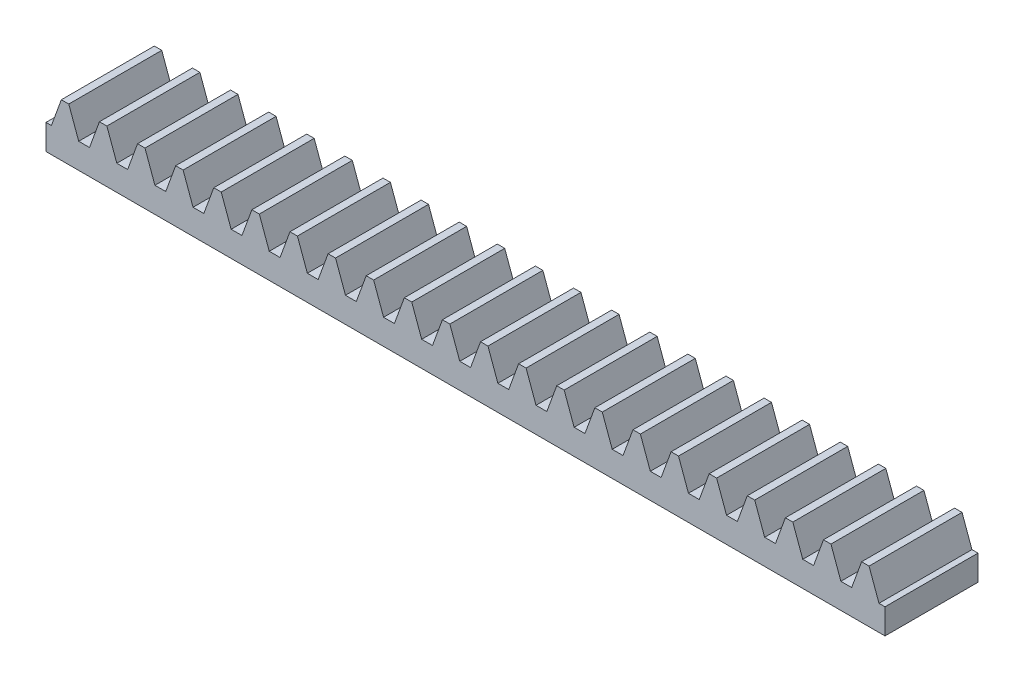
from build123d import *

# Parameters (mm, degrees)
BLANKSKE_W         = 41.5
BLANKSKE_H         = 2.6
BLANK_DEPTH        = 5
TOOTHCUTSIM_DEPTH  = 42.880902569
TEETHCUTS_COUNT    = 23
TEETHCUTS_PITCH    = 1.88495559
CUT_EXTRUDE1_DEPTH = 0.2
CUT_EXTRUDE2_DEPTH = 0.2


with BuildPart() as part:
    # BlankSke → Blank (new body)
    with BuildSketch(Plane.XY):
        with Locations((20.75, 1.3)):
            Rectangle(BLANKSKE_W, BLANKSKE_H)
    extrude(amount=-BLANK_DEPTH)

    # TooCutSkeSim → ToothCutSim (cut, through all)
    with BuildSketch(Plane.XY):
        Polygon((0.267261222, 1.25), (-0.267261222, 1.25), (-0.767865882, 2.6254), (0.767865882, 2.6254), align=None)
    toothcutsim = extrude(amount=-TOOTHCUTSIM_DEPTH, mode=Mode.SUBTRACT)

    # TeethCuts: ToothCutSim ×23
    with Locations(*[(i * TEETHCUTS_PITCH, 0, 0) for i in range(1, TEETHCUTS_COUNT)]):
        add(toothcutsim, mode=Mode.SUBTRACT)

    # Sketch1 → Cut-Extrude1 (cut)
    with BuildSketch(Plane.XY):
        Polygon((41.5, 1.25), (41.201761758, 1.25), (40.710401942, 2.6), (40.342688428, 2.6), (39.851328612, 1.25), (39.316806168, 1.25), (38.825446352, 2.6), (38.457732838, 2.6), (37.966373022, 1.25), (37.431850578, 1.25), (36.940490762, 2.6), (36.572777248, 2.6), (36.081417432, 1.25), (35.546894988, 1.25), (35.055535172, 2.6), (34.687821658, 2.6), (34.196461842, 1.25), (33.661939398, 1.25), (33.170579582, 2.6), (32.802866068, 2.6), (32.311506252, 1.25), (31.776983808, 1.25), (31.285623992, 2.6), (30.917910478, 2.6), (30.426550662, 1.25), (29.892028218, 1.25), (29.400668402, 2.6), (29.032954888, 2.6), (28.541595072, 1.25), (28.007072628, 1.25), (27.515712812, 2.6), (27.147999298, 2.6), (26.656639482, 1.25), (26.122117038, 1.25), (25.630757222, 2.6), (25.263043708, 2.6), (24.771683892, 1.25), (24.237161448, 1.25), (23.745801632, 2.6), (23.378088118, 2.6), (22.886728302, 1.25), (22.352205858, 1.25), (21.860846042, 2.6), (21.493132528, 2.6), (21.001772712, 1.25), (20.467250268, 1.25), (19.975890452, 2.6), (19.608176938, 2.6), (19.116817122, 1.25), (18.582294678, 1.25), (18.090934862, 2.6), (17.723221348, 2.6), (17.231861532, 1.25), (16.697339088, 1.25), (16.205979272, 2.6), (15.838265758, 2.6), (15.346905942, 1.25), (14.812383498, 1.25), (14.321023682, 2.6), (13.953310168, 2.6), (13.461950352, 1.25), (12.927427908, 1.25), (12.436068092, 2.6), (12.068354578, 2.6), (11.576994762, 1.25), (11.042472318, 1.25), (10.551112502, 2.6), (10.183398988, 2.6), (9.692039172, 1.25), (9.157516728, 1.25), (8.666156912, 2.6), (8.298443398, 2.6), (7.807083582, 1.25), (7.272561138, 1.25), (6.781201322, 2.6), (6.413487808, 2.6), (5.922127992, 1.25), (5.387605548, 1.25), (4.896245732, 2.6), (4.528532218, 2.6), (4.037172402, 1.25), (3.502649958, 1.25), (3.011290142, 2.6), (2.643576628, 2.6), (2.152216812, 1.25), (1.617694368, 1.25), (1.126334552, 2.6), (0.758621038, 2.6), (0.267261222, 1.25), (0, 1.25), (0, 0), (41.5, 0), align=None)
    extrude(amount=-CUT_EXTRUDE1_DEPTH, mode=Mode.SUBTRACT)

    # Sketch2 → Cut-Extrude2 (cut)
    with BuildSketch(Plane(origin=(0, 0, -5), x_dir=(-1, 0, 0), z_dir=(0, 0, -1))):
        Polygon((-40.710401942, 2.6), (-41.201761758, 1.25), (-41.5, 1.25), (-41.5, 0), (0, 0), (0, 1.25), (-0.267261222, 1.25), (-0.758621038, 2.6), (-1.126334552, 2.6), (-1.617694368, 1.25), (-2.152216812, 1.25), (-2.643576628, 2.6), (-3.011290142, 2.6), (-3.502649958, 1.25), (-4.037172402, 1.25), (-4.528532218, 2.6), (-4.896245732, 2.6), (-5.387605548, 1.25), (-5.922127992, 1.25), (-6.413487808, 2.6), (-6.781201322, 2.6), (-7.272561138, 1.25), (-7.807083582, 1.25), (-8.298443398, 2.6), (-8.666156912, 2.6), (-9.157516728, 1.25), (-9.692039172, 1.25), (-10.183398988, 2.6), (-10.551112502, 2.6), (-11.042472318, 1.25), (-11.576994762, 1.25), (-12.068354578, 2.6), (-12.436068092, 2.6), (-12.927427908, 1.25), (-13.461950352, 1.25), (-13.953310168, 2.6), (-14.321023682, 2.6), (-14.812383498, 1.25), (-15.346905942, 1.25), (-15.838265758, 2.6), (-16.205979272, 2.6), (-16.697339088, 1.25), (-17.231861532, 1.25), (-17.723221348, 2.6), (-18.090934862, 2.6), (-18.582294678, 1.25), (-19.116817122, 1.25), (-19.608176938, 2.6), (-19.975890452, 2.6), (-20.467250268, 1.25), (-21.001772712, 1.25), (-21.493132528, 2.6), (-21.860846042, 2.6), (-22.352205858, 1.25), (-22.886728302, 1.25), (-23.378088118, 2.6), (-23.745801632, 2.6), (-24.237161448, 1.25), (-24.771683892, 1.25), (-25.263043708, 2.6), (-25.630757222, 2.6), (-26.122117038, 1.25), (-26.656639482, 1.25), (-27.147999298, 2.6), (-27.515712812, 2.6), (-28.007072628, 1.25), (-28.541595072, 1.25), (-29.032954888, 2.6), (-29.400668402, 2.6), (-29.892028218, 1.25), (-30.426550662, 1.25), (-30.917910478, 2.6), (-31.285623992, 2.6), (-31.776983808, 1.25), (-32.311506252, 1.25), (-32.802866068, 2.6), (-33.170579582, 2.6), (-33.661939398, 1.25), (-34.196461842, 1.25), (-34.687821658, 2.6), (-35.055535172, 2.6), (-35.546894988, 1.25), (-36.081417432, 1.25), (-36.572777248, 2.6), (-36.940490762, 2.6), (-37.431850578, 1.25), (-37.966373022, 1.25), (-38.457732838, 2.6), (-38.825446352, 2.6), (-39.316806168, 1.25), (-39.851328612, 1.25), (-40.342688428, 2.6), align=None)
    extrude(amount=-CUT_EXTRUDE2_DEPTH, mode=Mode.SUBTRACT)


solid = part.part
